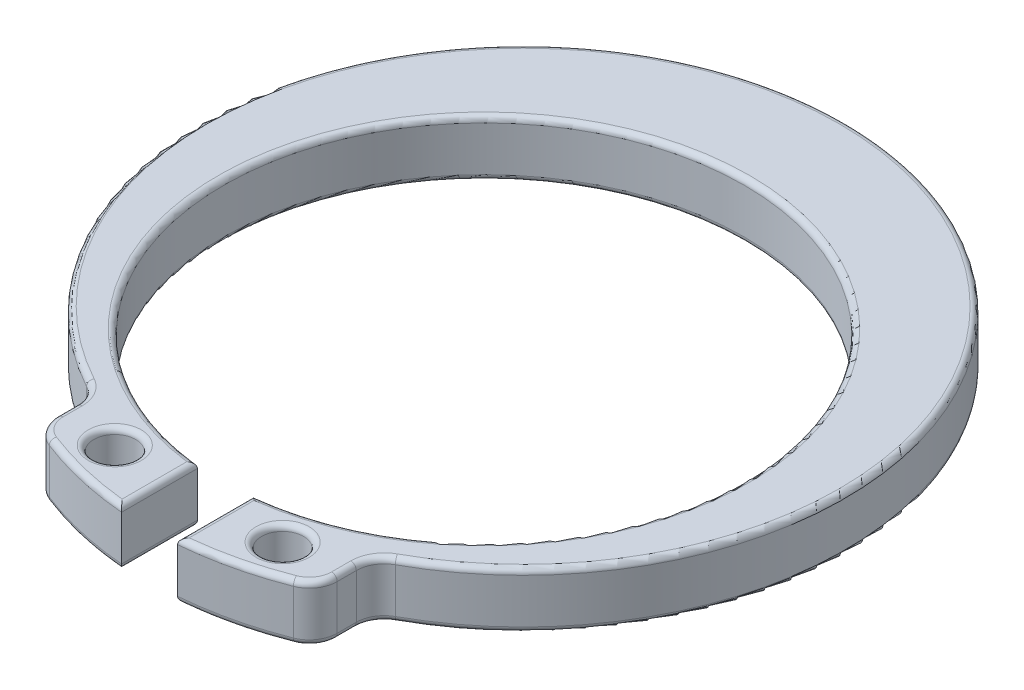
from build123d import *

# Parameters (mm, degrees)
SKETCH_1_R      = 0.375
EXTRUDE_1_DEPTH = 1
FILLET_1_R      = 0.5
FILLET_2_R      = 0.1


with BuildPart() as part:
    # 草图1 → 凸台-拉伸1 (new body)
    with BuildSketch(Plane(origin=(0, 0, 0), x_dir=(1, 0, 0), z_dir=(0, 1, 0))):
        with BuildLine():
            Line((0.5, -4.623040125), (0.5, -5.979130372))
            ThreePointArc((0.5, -5.979130372), (1.52277609, -5.803546586), (2.5, -5.454356057))
            Line((2.5, -5.454356057), (2.5, -4.478078794))
            ThreePointArc((2.5, -4.478078794), (0, 6.45), (-2.5, -4.478078794))
            Line((-2.5, -4.478078794), (-2.5, -5.454356057))
            ThreePointArc((-2.5, -5.454356057), (-1.52277609, -5.803546586), (-0.5, -5.979130372))
            Line((-0.5, -5.979130372), (-0.5, -4.623040125))
            ThreePointArc((-0.5, -4.623040125), (0, 4.65), (0.5, -4.623040125))
        make_face()
        with Locations(Location((1.5, -5.1, 0), (0, 0, 270))):
            Circle(SKETCH_1_R, mode=Mode.SUBTRACT)
        with Locations(Location((-1.5, -5.1, 0), (0, 0, 90))):
            Circle(SKETCH_1_R, mode=Mode.SUBTRACT)
    extrude(amount=EXTRUDE_1_DEPTH)

    # 圆角1
    fillet_1_edges = [part.edges().sort_by_distance(p)[0] for p in [
        (2.5, 0.5, 4.478078794),
        (2.5, 0.5, 5.454356057),
        (-2.5, 0.5, 5.454356057),
        (-2.5, 0.5, 4.478078794),
    ]]
    fillet(fillet_1_edges, radius=FILLET_1_R)

    # 圆角2
    fillet_2_edges = [part.edges().sort_by_distance(p)[0] for p in [
        (-0.5, 0, 5.301085248),
        (-0.5, 1, 5.301085248),
        (0, 1, -4.65),
        (1.5, 0, 4.725),
        (1.5, 1, 4.725),
        (0.5, 1, 5.301085248),
        (-1.5, 0, 5.475),
        (-1.5, 1, 5.475),
        (1.355005414, 1, 5.844994468),
        (-1.355005414, 0, 5.844994468),
        (-1.355005414, 1, 5.844994468),
        (0, 0, -6.45),
        (2.5, 0, 4.953201716),
        (-2.5, 0, 4.953201716),
        (2.412861412, 0, 5.40551342),
        (-2.412861412, 0, 5.40551342),
        (-2.5, 1, 4.953201716),
        (0, 1, -6.45),
        (2.5, 1, 4.953201716),
        (2.412861412, 1, 5.40551342),
        (-2.412861412, 1, 5.40551342),
        (-2.569883737, 0, 4.527977074),
        (-2.569883737, 1, 4.527977074),
        (2.569883737, 0, 4.527977074),
        (2.569883737, 1, 4.527977074),
        (1.355005414, 0, 5.844994468),
        (0.5, 0, 5.301085248),
        (0, 0, -4.65),
    ]]
    fillet(fillet_2_edges, radius=FILLET_2_R)


solid = part.part
